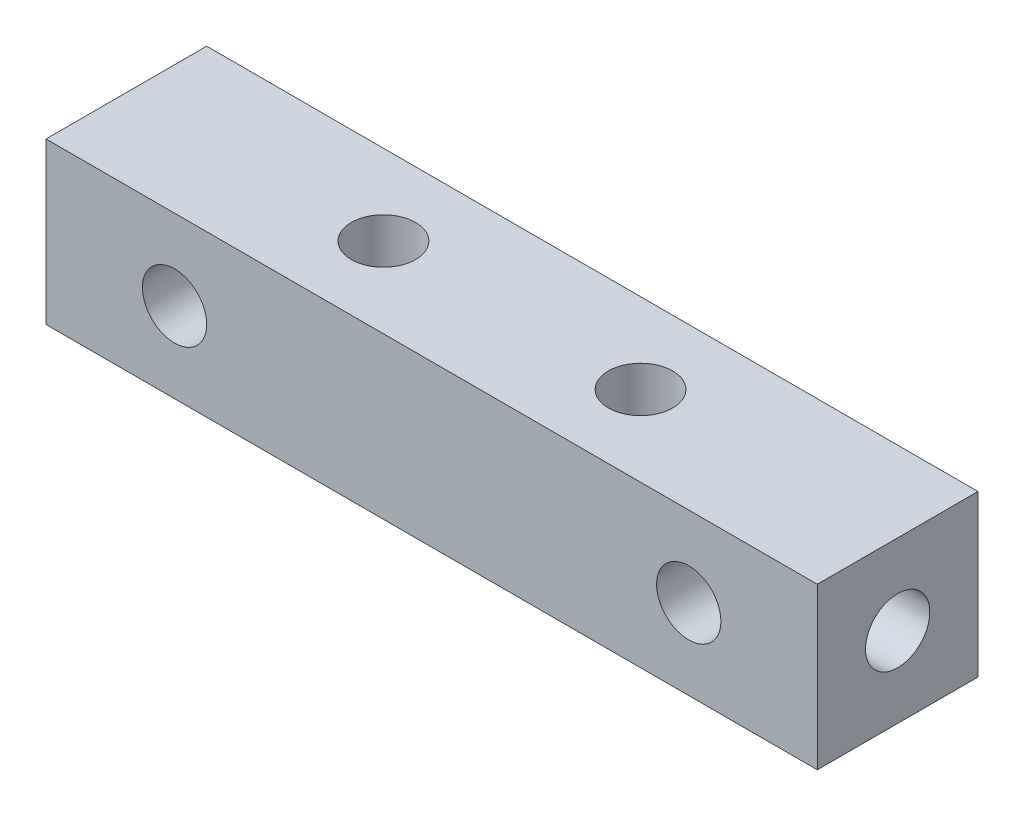
from build123d import *

# Parameters (mm, degrees)
SKETCH_1_W          = 48
SKETCH_1_H          = 10
EXTRUDE_1_DEPTH     = 10
SKETCH_2_R          = 2
CUT_EXTRUDE_1_DEPTH = 10
SKETCH_3_R          = 2
CUT_EXTRUDE_2_DEPTH = 10
SKETCH_4_R          = 2
CUT_EXTRUDE_3_DEPTH = 8


with BuildPart() as part:
    # 草图1 → 凸台-拉伸1 (new body)
    with BuildSketch(Plane(origin=(0, 0, 0), x_dir=(1, 0, 0), z_dir=(0, 1, 0))):
        Rectangle(SKETCH_1_W, SKETCH_1_H)
    extrude(amount=EXTRUDE_1_DEPTH)

    # 草图2 → 切除-拉伸1 (cut)
    with BuildSketch(Plane.XY.offset(5)):
        with Locations((-16, 5)):
            Circle(SKETCH_2_R)
        with Locations((16, 5)):
            Circle(SKETCH_2_R)
    extrude(amount=-CUT_EXTRUDE_1_DEPTH, mode=Mode.SUBTRACT)

    # 草图3 → 切除-拉伸2 (cut)
    with BuildSketch(Plane(origin=(0, 10, 0), x_dir=(1, 0, 0), z_dir=(0, 1, 0))):
        with Locations(Location((-8, 0, 0), (0, 0, 270))):
            Circle(SKETCH_3_R)
        with Locations(Location((8, 0, 0), (0, 0, 270))):
            Circle(SKETCH_3_R)
    extrude(amount=-CUT_EXTRUDE_2_DEPTH, mode=Mode.SUBTRACT)

    # 草图4 → 切除-拉伸3 (cut)
    with BuildSketch(Plane.ZY.offset(24)):
        with Locations((0, 5)):
            Circle(SKETCH_4_R)
    cut_extrude_3 = extrude(amount=-CUT_EXTRUDE_3_DEPTH, mode=Mode.SUBTRACT)

    # 镜向1: 切除-拉伸3 across plane
    add(cut_extrude_3.mirror(Plane(origin=(0, 0, 0), x_dir=(0, 0, 1), z_dir=(1, 0, 0))), mode=Mode.SUBTRACT)


solid = part.part
